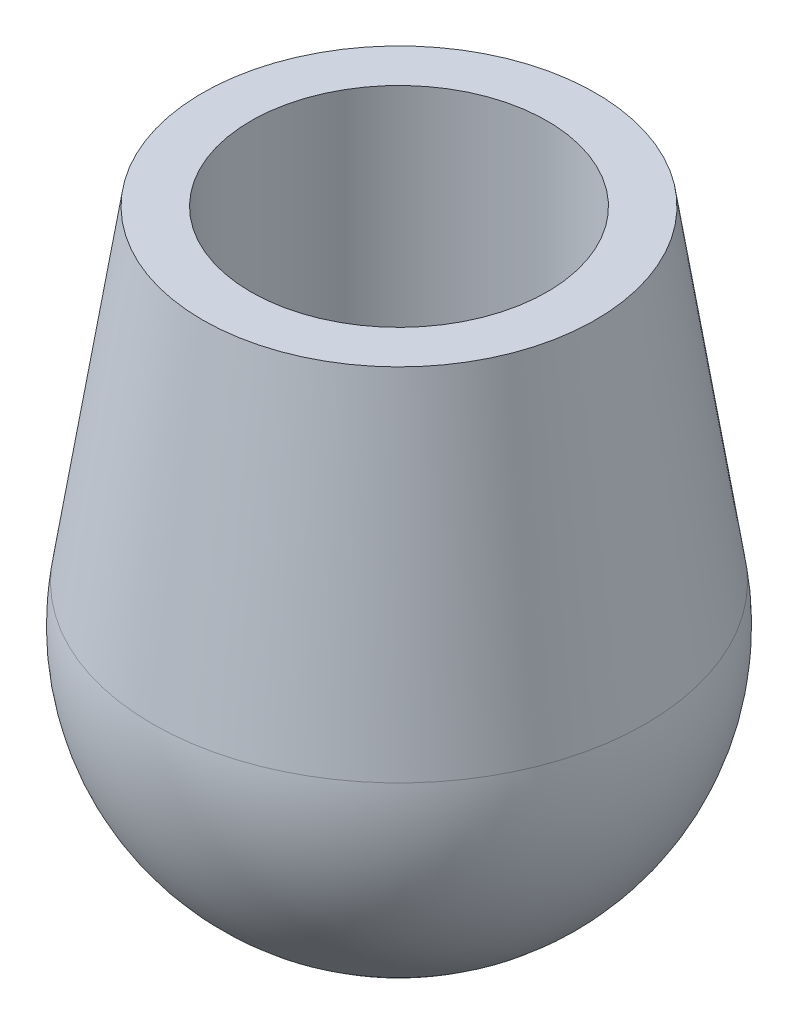
from build123d import *


with BuildPart() as part:
    # Esquisse1 → Révolution1 (revolve)
    with BuildSketch(Plane.XY, mode=Mode.PRIVATE) as r_volution1_sk:
        with BuildLine():
            Line((0, 0), (7.65, 0))
            Line((7.65, 0), (7.65, 25))
            Line((7.65, 25), (10.15, 25))
            Line((10.15, 25), (12.726918576, 8.218379822))
            ThreePointArc((12.726918576, 8.218379822), (9.771320344, -2.121320344), (0, -6.612006167))
            Line((0, -6.612006167), (0, 0))
        make_face()
    revolve(r_volution1_sk.sketch.rotate(Axis((0, 0, 0), (0, -1, 0)), 90), axis=Axis((0, 0, 0), (0, -1, 0)))


solid = part.part
